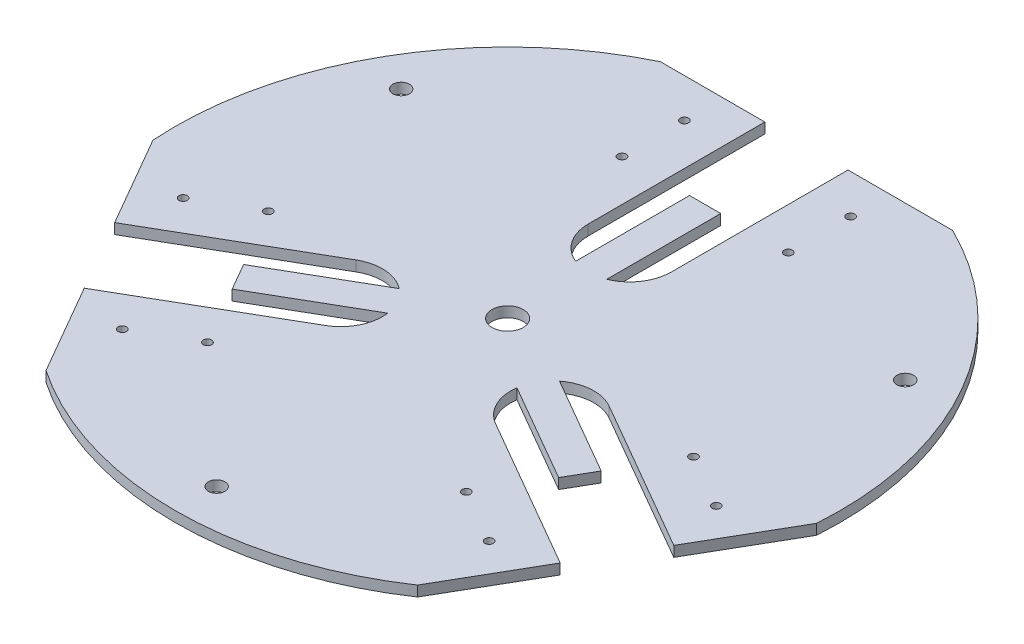
from build123d import *

# Parameters (mm, degrees)
SKETCH1_R           = 2
SKETCH1_R_2         = 4
SKETCH1_R_3         = 7.5
BOSS_EXTRUDE1_DEPTH = 5


with BuildPart() as part:
    # Sketch1 → Boss-Extrude1 (new body)
    with BuildSketch(Plane(origin=(0, 0, 0), x_dir=(1, 0, 0), z_dir=(0, 1, 0))):
        with BuildLine():
            Line((-20, 143.745078664), (-20, 58.745078664))
            ThreePointArc((-20, 58.745078664), (-16.583123952, 47.564738776), (-7.5, 40.204582446))
            Line((-7.5, 40.204582446), (-7.5, 95))
            Line((-7.5, 95), (7.5, 95))
            Line((7.5, 95), (7.5, 40.204582446))
            ThreePointArc((7.5, 40.204582446), (16.583123952, 47.564738776), (20, 58.745078664))
            Line((20, 58.745078664), (20, 143.745078664))
            Line((20, 143.745078664), (70.266296045, 143.745078664))
            ThreePointArc((70.266296045, 143.745078664), (138.564064606, 80), (159.620037815, -11.020141927))
            Line((159.620037815, -11.020141927), (134.486889792, -54.552031256))
            Line((134.486889792, -54.552031256), (60.87473047, -12.052031256))
            ThreePointArc((60.87473047, -12.052031256), (49.483834081, -9.420962772), (38.568189747, -13.607100695))
            Line((38.568189747, -13.607100695), (86.02241336, -41.004809472))
            Line((86.02241336, -41.004809472), (78.52241336, -53.995190528))
            Line((78.52241336, -53.995190528), (31.068189747, -26.597481751))
            ThreePointArc((31.068189747, -26.597481751), (32.900710129, -38.143776005), (40.87473047, -46.693047408))
            Line((40.87473047, -46.693047408), (114.486889792, -89.193047408))
            Line((114.486889792, -89.193047408), (89.353741769, -132.724936737))
            ThreePointArc((89.353741769, -132.724936737), (0, -160), (-89.353741769, -132.724936737))
            Line((-89.353741769, -132.724936737), (-114.486889792, -89.193047408))
            Line((-114.486889792, -89.193047408), (-40.87473047, -46.693047408))
            ThreePointArc((-40.87473047, -46.693047408), (-32.900710129, -38.143776005), (-31.068189747, -26.597481751))
            Line((-31.068189747, -26.597481751), (-78.52241336, -53.995190528))
            Line((-78.52241336, -53.995190528), (-86.02241336, -41.004809472))
            Line((-86.02241336, -41.004809472), (-38.568189747, -13.607100695))
            ThreePointArc((-38.568189747, -13.607100695), (-49.483834081, -9.420962772), (-60.87473047, -12.052031256))
            Line((-60.87473047, -12.052031256), (-134.486889792, -54.552031256))
            Line((-134.486889792, -54.552031256), (-159.620037815, -11.020141927))
            ThreePointArc((-159.620037815, -11.020141927), (-138.564064606, 80), (-70.266296045, 143.745078664))
            Line((-70.266296045, 143.745078664), (-20, 143.745078664))
        make_face()
        with Locations(Location((40, 125, 0), (0, 0, 270))):
            Circle(SKETCH1_R, mode=Mode.SUBTRACT)
        with Locations(Location((40, 95, 0), (0, 0, 270))):
            Circle(SKETCH1_R, mode=Mode.SUBTRACT)
        with Locations(Location((-40, 95, 0), (0, 0, 90))):
            Circle(SKETCH1_R, mode=Mode.SUBTRACT)
        with Locations(Location((-40, 125, 0), (0, 0, 90))):
            Circle(SKETCH1_R, mode=Mode.SUBTRACT)
        with Locations(Location((102.27241336, -12.858983849, 0), (0, 0, 90))):
            Circle(SKETCH1_R, mode=Mode.SUBTRACT)
        with Locations(Location((128.253175473, -27.858983849, 0), (0, 0, 90))):
            Circle(SKETCH1_R, mode=Mode.SUBTRACT)
        with Locations(Location((88.253175473, -97.141016151, 0), (0, 0, 270))):
            Circle(SKETCH1_R, mode=Mode.SUBTRACT)
        with Locations(Location((62.27241336, -82.141016151, 0), (0, 0, 270))):
            Circle(SKETCH1_R, mode=Mode.SUBTRACT)
        with Locations(Location((-62.272413359, -82.141016151, 0), (0, 0, 90))):
            Circle(SKETCH1_R, mode=Mode.SUBTRACT)
        with Locations(Location((-88.253175473, -97.141016151, 0), (0, 0, 90))):
            Circle(SKETCH1_R, mode=Mode.SUBTRACT)
        with Locations(Location((-128.253175473, -27.858983849, 0), (0, 0, 270))):
            Circle(SKETCH1_R, mode=Mode.SUBTRACT)
        with Locations(Location((-102.272413359, -12.858983849, 0), (0, 0, 270))):
            Circle(SKETCH1_R, mode=Mode.SUBTRACT)
        with Locations(Location((0, -140, 0), (0, 0, 270))):
            Circle(SKETCH1_R_2, mode=Mode.SUBTRACT)
        with Locations(Location((-121.24355653, 70, 0), (0, 0, 270))):
            Circle(SKETCH1_R_2, mode=Mode.SUBTRACT)
        with Locations(Location((121.24355653, 70, 0), (0, 0, 270))):
            Circle(SKETCH1_R_2, mode=Mode.SUBTRACT)
        with Locations(Location((0, 0, 0), (0, 0, 270))):
            Circle(SKETCH1_R_3, mode=Mode.SUBTRACT)
    extrude(amount=BOSS_EXTRUDE1_DEPTH)


solid = part.part
